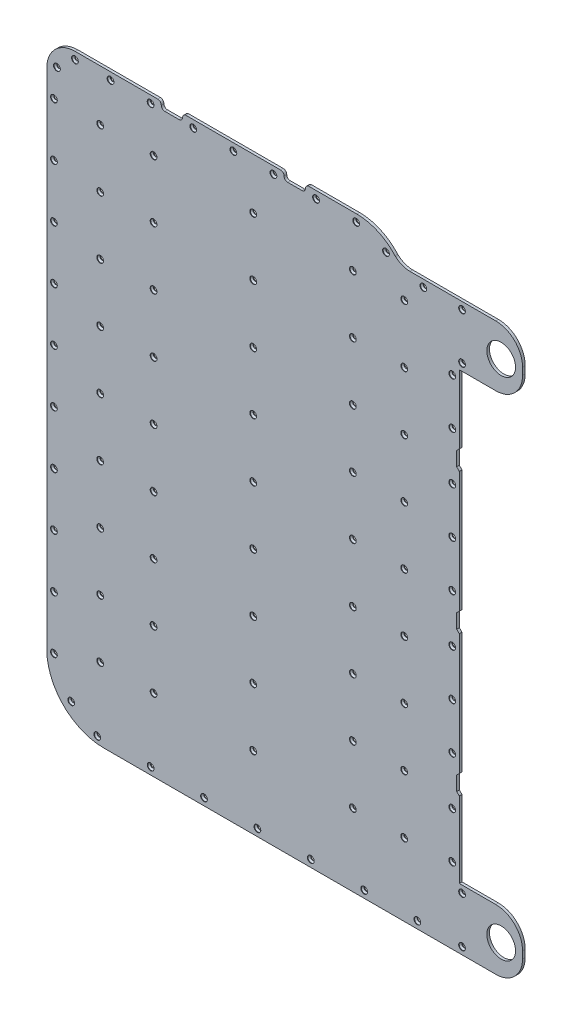
from build123d import *

# Parameters (mm, degrees)
SKETCH1_W                                      = 267.354069382
SKETCH1_H                                      = 331
BOSS_EXTRUDE1_DEPTH                            = 1.5
CUT_EXTRUDE1_DEPTH                             = 426.489657236
CUT_EXTRUDE2_DEPTH                             = 426.489657236
CUT_EXTRUDE3_DEPTH                             = 426.489657236
CUT_EXTRUDE4_DEPTH                             = 426.489657236
M14_CLEARANCE_HOLE1_D                          = 16.15
CSK_FOR_M2_FLAT_HEAD_MACHINE_SCREW1_AT_2_COUNT = 2
CSK_FOR_M2_FLAT_HEAD_MACHINE_SCREW1_AT_2_PITCH = 119.634610245
CSK_FOR_M2_FLAT_HEAD_MACHINE_SCREW1_AT_3_COUNT = 2
CSK_FOR_M2_FLAT_HEAD_MACHINE_SCREW1_AT_3_PITCH = 261.247192787
CSK_FOR_M2_FLAT_HEAD_MACHINE_SCREW1_AT_4_COUNT = 2
CSK_FOR_M2_FLAT_HEAD_MACHINE_SCREW1_AT_4_PITCH = 200.44941981
CSK_FOR_M2_FLAT_HEAD_MACHINE_SCREW1_AT_5_COUNT = 2
CSK_FOR_M2_FLAT_HEAD_MACHINE_SCREW1_AT_5_PITCH = 60
CSK_FOR_M2_FLAT_HEAD_MACHINE_SCREW1_AT_6_COUNT = 2
CSK_FOR_M2_FLAT_HEAD_MACHINE_SCREW1_AT_6_PITCH = 150
CSK_FOR_M2_FLAT_HEAD_MACHINE_SCREW1_AT_7_COUNT = 2
CSK_FOR_M2_FLAT_HEAD_MACHINE_SCREW1_AT_7_PITCH = 104.020522584
CSK_FOR_M2_FLAT_HEAD_MACHINE_SCREW1_AT_8_COUNT = 2
CSK_FOR_M2_FLAT_HEAD_MACHINE_SCREW1_AT_8_PITCH = 304.224078439
CSK_FOR_M2_FLAT_HEAD_MACHINE_SCREW1_AT_9_COUNT = 2
CSK_FOR_M2_FLAT_HEAD_MACHINE_SCREW1_AT_9_PITCH = 241.10255073
CSK_FOR_M2_FLAT_HEAD_MACHINE_SCREW1_AT_1_COUNT = 2
CSK_FOR_M2_FLAT_HEAD_MACHINE_SCREW1_AT_1_PITCH = 151.792937809
CSK_FOR_M2_FLAT_HEAD_MACHINE_SCREW1_2_COUNT    = 2
CSK_FOR_M2_FLAT_HEAD_MACHINE_SCREW1_2_PITCH    = 167.620476666
CSK_FOR_M2_FLAT_HEAD_MACHINE_SCREW1_3_COUNT    = 2
CSK_FOR_M2_FLAT_HEAD_MACHINE_SCREW1_3_PITCH    = 120
CSK_FOR_M2_FLAT_HEAD_MACHINE_SCREW1_4_COUNT    = 2
CSK_FOR_M2_FLAT_HEAD_MACHINE_SCREW1_4_PITCH    = 223.752496974
CSK_FOR_M2_FLAT_HEAD_MACHINE_SCREW1_5_COUNT    = 2
CSK_FOR_M2_FLAT_HEAD_MACHINE_SCREW1_5_PITCH    = 72.949696793
CSK_FOR_M2_FLAT_HEAD_MACHINE_SCREW1_6_COUNT    = 2
CSK_FOR_M2_FLAT_HEAD_MACHINE_SCREW1_6_PITCH    = 295.031085667
CSK_FOR_M2_FLAT_HEAD_MACHINE_SCREW1_7_COUNT    = 2
CSK_FOR_M2_FLAT_HEAD_MACHINE_SCREW1_7_PITCH    = 123.913581739
CSK_FOR_M2_FLAT_HEAD_MACHINE_SCREW1_8_COUNT    = 2
CSK_FOR_M2_FLAT_HEAD_MACHINE_SCREW1_8_PITCH    = 228.699238106
CSK_FOR_M2_FLAT_HEAD_MACHINE_SCREW1_9_COUNT    = 2
CSK_FOR_M2_FLAT_HEAD_MACHINE_SCREW1_9_PITCH    = 164.927901109
CSK_FOR_M2_FLAT_HEAD_MACHINE_SCREW1_10_COUNT   = 2
CSK_FOR_M2_FLAT_HEAD_MACHINE_SCREW1_10_PITCH   = 361.458404112
CSK_FOR_M2_FLAT_HEAD_MACHINE_SCREW1_11_COUNT   = 2
CSK_FOR_M2_FLAT_HEAD_MACHINE_SCREW1_11_PITCH   = 177.537391413
CSK_FOR_M2_FLAT_HEAD_MACHINE_SCREW1_12_COUNT   = 2
CSK_FOR_M2_FLAT_HEAD_MACHINE_SCREW1_12_PITCH   = 233.98480722
CSK_FOR_M2_FLAT_HEAD_MACHINE_SCREW1_13_COUNT   = 2
CSK_FOR_M2_FLAT_HEAD_MACHINE_SCREW1_13_PITCH   = 345.258369211
CSK_FOR_M2_FLAT_HEAD_MACHINE_SCREW1_14_COUNT   = 2
CSK_FOR_M2_FLAT_HEAD_MACHINE_SCREW1_14_PITCH   = 323.987285133
CSK_FOR_M2_FLAT_HEAD_MACHINE_SCREW1_15_COUNT   = 2
CSK_FOR_M2_FLAT_HEAD_MACHINE_SCREW1_15_PITCH   = 322.888559698
CSK_FOR_M2_FLAT_HEAD_MACHINE_SCREW1_16_COUNT   = 2
CSK_FOR_M2_FLAT_HEAD_MACHINE_SCREW1_16_PITCH   = 266.552202251
CSK_FOR_M2_FLAT_HEAD_MACHINE_SCREW1_17_COUNT   = 2
CSK_FOR_M2_FLAT_HEAD_MACHINE_SCREW1_17_PITCH   = 314.841229829
CSK_FOR_M2_FLAT_HEAD_MACHINE_SCREW1_18_COUNT   = 2
CSK_FOR_M2_FLAT_HEAD_MACHINE_SCREW1_18_PITCH   = 316.809987117
CSK_FOR_M2_FLAT_HEAD_MACHINE_SCREW1_19_COUNT   = 2
CSK_FOR_M2_FLAT_HEAD_MACHINE_SCREW1_19_PITCH   = 227.93936126
CSK_FOR_M2_FLAT_HEAD_MACHINE_SCREW1_20_COUNT   = 2
CSK_FOR_M2_FLAT_HEAD_MACHINE_SCREW1_20_PITCH   = 180.092587027
CSK_FOR_M2_FLAT_HEAD_MACHINE_SCREW1_21_COUNT   = 2
CSK_FOR_M2_FLAT_HEAD_MACHINE_SCREW1_21_PITCH   = 279.91283558
CSK_FOR_M2_FLAT_HEAD_MACHINE_SCREW1_22_COUNT   = 2
CSK_FOR_M2_FLAT_HEAD_MACHINE_SCREW1_22_PITCH   = 232.986660987
CSK_FOR_M2_FLAT_HEAD_MACHINE_SCREW1_23_COUNT   = 2
CSK_FOR_M2_FLAT_HEAD_MACHINE_SCREW1_23_PITCH   = 62.685137884
CSK_FOR_M2_FLAT_HEAD_MACHINE_SCREW1_24_COUNT   = 2
CSK_FOR_M2_FLAT_HEAD_MACHINE_SCREW1_24_PITCH   = 272.821168476
CSK_FOR_M2_FLAT_HEAD_MACHINE_SCREW1_25_COUNT   = 2
CSK_FOR_M2_FLAT_HEAD_MACHINE_SCREW1_25_PITCH   = 352.917909887
CSK_FOR_M2_FLAT_HEAD_MACHINE_SCREW1_26_COUNT   = 2
CSK_FOR_M2_FLAT_HEAD_MACHINE_SCREW1_26_PITCH   = 298.36766614
CSK_FOR_M2_FLAT_HEAD_MACHINE_SCREW1_27_COUNT   = 2
CSK_FOR_M2_FLAT_HEAD_MACHINE_SCREW1_27_PITCH   = 304.747305105
CSK_FOR_M2_FLAT_HEAD_MACHINE_SCREW1_28_COUNT   = 2
CSK_FOR_M2_FLAT_HEAD_MACHINE_SCREW1_28_PITCH   = 178.729628122
CSK_FOR_M2_FLAT_HEAD_MACHINE_SCREW1_29_COUNT   = 2
CSK_FOR_M2_FLAT_HEAD_MACHINE_SCREW1_29_PITCH   = 148.522961082
CSK_FOR_M2_FLAT_HEAD_MACHINE_SCREW1_30_COUNT   = 2
CSK_FOR_M2_FLAT_HEAD_MACHINE_SCREW1_30_PITCH   = 176.588055967
CSK_FOR_M2_FLAT_HEAD_MACHINE_SCREW1_31_COUNT   = 2
CSK_FOR_M2_FLAT_HEAD_MACHINE_SCREW1_31_PITCH   = 358.429099418
CSK_FOR_M2_FLAT_HEAD_MACHINE_SCREW1_32_COUNT   = 2
CSK_FOR_M2_FLAT_HEAD_MACHINE_SCREW1_32_PITCH   = 200.300809279
CSK_FOR_M2_FLAT_HEAD_MACHINE_SCREW1_33_COUNT   = 2
CSK_FOR_M2_FLAT_HEAD_MACHINE_SCREW1_33_PITCH   = 43.034312803
CSK_FOR_M2_FLAT_HEAD_MACHINE_SCREW1_34_COUNT   = 2
CSK_FOR_M2_FLAT_HEAD_MACHINE_SCREW1_34_PITCH   = 69.690273336
CSK_FOR_M2_FLAT_HEAD_MACHINE_SCREW1_35_COUNT   = 2
CSK_FOR_M2_FLAT_HEAD_MACHINE_SCREW1_35_PITCH   = 156.307695714
CSK_FOR_M2_FLAT_HEAD_MACHINE_SCREW1_36_COUNT   = 2
CSK_FOR_M2_FLAT_HEAD_MACHINE_SCREW1_36_PITCH   = 319.723851957
CSK_FOR_M2_FLAT_HEAD_MACHINE_SCREW1_37_COUNT   = 2
CSK_FOR_M2_FLAT_HEAD_MACHINE_SCREW1_37_PITCH   = 326.860477855
CSK_FOR_M2_FLAT_HEAD_MACHINE_SCREW1_38_COUNT   = 2
CSK_FOR_M2_FLAT_HEAD_MACHINE_SCREW1_38_PITCH   = 179.384296245
CSK_FOR_M2_FLAT_HEAD_MACHINE_SCREW1_39_COUNT   = 2
CSK_FOR_M2_FLAT_HEAD_MACHINE_SCREW1_39_PITCH   = 271.409914171
CSK_FOR_M2_FLAT_HEAD_MACHINE_SCREW1_40_COUNT   = 2
CSK_FOR_M2_FLAT_HEAD_MACHINE_SCREW1_40_PITCH   = 60.829191626
CSK_FOR_M2_FLAT_HEAD_MACHINE_SCREW1_41_COUNT   = 2
CSK_FOR_M2_FLAT_HEAD_MACHINE_SCREW1_41_PITCH   = 81.288620654
CSK_FOR_M2_FLAT_HEAD_MACHINE_SCREW1_42_COUNT   = 2
CSK_FOR_M2_FLAT_HEAD_MACHINE_SCREW1_42_PITCH   = 137.200749777
CSK_FOR_M2_FLAT_HEAD_MACHINE_SCREW1_43_COUNT   = 2
CSK_FOR_M2_FLAT_HEAD_MACHINE_SCREW1_43_PITCH   = 299.148530157
CSK_FOR_M2_FLAT_HEAD_MACHINE_SCREW1_44_COUNT   = 2
CSK_FOR_M2_FLAT_HEAD_MACHINE_SCREW1_44_PITCH   = 136.663128881
CSK_FOR_M2_FLAT_HEAD_MACHINE_SCREW1_45_COUNT   = 2
CSK_FOR_M2_FLAT_HEAD_MACHINE_SCREW1_45_PITCH   = 336.827510729
CSK_FOR_M2_FLAT_HEAD_MACHINE_SCREW1_46_COUNT   = 2
CSK_FOR_M2_FLAT_HEAD_MACHINE_SCREW1_46_PITCH   = 331.117837006
CSK_FOR_M2_FLAT_HEAD_MACHINE_SCREW1_47_COUNT   = 2
CSK_FOR_M2_FLAT_HEAD_MACHINE_SCREW1_47_PITCH   = 320.921447927
CSK_FOR_M2_FLAT_HEAD_MACHINE_SCREW1_48_COUNT   = 2
CSK_FOR_M2_FLAT_HEAD_MACHINE_SCREW1_48_PITCH   = 344.446706307
CSK_FOR_M2_FLAT_HEAD_MACHINE_SCREW1_49_COUNT   = 2
CSK_FOR_M2_FLAT_HEAD_MACHINE_SCREW1_49_PITCH   = 209.685645595
CSK_FOR_M2_FLAT_HEAD_MACHINE_SCREW1_50_COUNT   = 2
CSK_FOR_M2_FLAT_HEAD_MACHINE_SCREW1_50_PITCH   = 90
CSK_FOR_M2_FLAT_HEAD_MACHINE_SCREW1_51_COUNT   = 2
CSK_FOR_M2_FLAT_HEAD_MACHINE_SCREW1_51_PITCH   = 152.826110015
CSK_FOR_M2_FLAT_HEAD_MACHINE_SCREW1_52_COUNT   = 2
CSK_FOR_M2_FLAT_HEAD_MACHINE_SCREW1_52_PITCH   = 93.297320264
CSK_FOR_M2_FLAT_HEAD_MACHINE_SCREW1_53_COUNT   = 2
CSK_FOR_M2_FLAT_HEAD_MACHINE_SCREW1_53_PITCH   = 289.276684162
CSK_FOR_M2_FLAT_HEAD_MACHINE_SCREW1_54_COUNT   = 2
CSK_FOR_M2_FLAT_HEAD_MACHINE_SCREW1_54_PITCH   = 311.778234918
CSK_FOR_M2_FLAT_HEAD_MACHINE_SCREW1_55_COUNT   = 2
CSK_FOR_M2_FLAT_HEAD_MACHINE_SCREW1_55_PITCH   = 254.363483823
CSK_FOR_M2_FLAT_HEAD_MACHINE_SCREW1_56_COUNT   = 2
CSK_FOR_M2_FLAT_HEAD_MACHINE_SCREW1_56_PITCH   = 201.460377121
CSK_FOR_M2_FLAT_HEAD_MACHINE_SCREW1_57_COUNT   = 2
CSK_FOR_M2_FLAT_HEAD_MACHINE_SCREW1_57_PITCH   = 202.637456713
CSK_FOR_M2_FLAT_HEAD_MACHINE_SCREW1_58_COUNT   = 2
CSK_FOR_M2_FLAT_HEAD_MACHINE_SCREW1_58_PITCH   = 169.003719323
CSK_FOR_M2_FLAT_HEAD_MACHINE_SCREW1_59_COUNT   = 2
CSK_FOR_M2_FLAT_HEAD_MACHINE_SCREW1_59_PITCH   = 290.77662516
CSK_FOR_M2_FLAT_HEAD_MACHINE_SCREW1_60_COUNT   = 2
CSK_FOR_M2_FLAT_HEAD_MACHINE_SCREW1_60_PITCH   = 265.675994771
CSK_FOR_M2_FLAT_HEAD_MACHINE_SCREW1_61_COUNT   = 2
CSK_FOR_M2_FLAT_HEAD_MACHINE_SCREW1_61_PITCH   = 205.094943232
CSK_FOR_M2_FLAT_HEAD_MACHINE_SCREW1_62_COUNT   = 2
CSK_FOR_M2_FLAT_HEAD_MACHINE_SCREW1_62_PITCH   = 210.531093927
CSK_FOR_M2_FLAT_HEAD_MACHINE_SCREW1_63_COUNT   = 2
CSK_FOR_M2_FLAT_HEAD_MACHINE_SCREW1_63_PITCH   = 30
CSK_FOR_M2_FLAT_HEAD_MACHINE_SCREW1_64_COUNT   = 2
CSK_FOR_M2_FLAT_HEAD_MACHINE_SCREW1_64_PITCH   = 183.748038112
CSK_FOR_M2_FLAT_HEAD_MACHINE_SCREW1_65_COUNT   = 2
CSK_FOR_M2_FLAT_HEAD_MACHINE_SCREW1_65_PITCH   = 72.352746793
CSK_FOR_M2_FLAT_HEAD_MACHINE_SCREW1_66_COUNT   = 2
CSK_FOR_M2_FLAT_HEAD_MACHINE_SCREW1_66_PITCH   = 195.303204045
CSK_FOR_M2_FLAT_HEAD_MACHINE_SCREW1_67_COUNT   = 2
CSK_FOR_M2_FLAT_HEAD_MACHINE_SCREW1_67_PITCH   = 249.176583776
CSK_FOR_M2_FLAT_HEAD_MACHINE_SCREW1_68_COUNT   = 2
CSK_FOR_M2_FLAT_HEAD_MACHINE_SCREW1_68_PITCH   = 276.1364516
CSK_FOR_M2_FLAT_HEAD_MACHINE_SCREW1_69_COUNT   = 2
CSK_FOR_M2_FLAT_HEAD_MACHINE_SCREW1_69_PITCH   = 102.297527818
CSK_FOR_M2_FLAT_HEAD_MACHINE_SCREW1_70_COUNT   = 2
CSK_FOR_M2_FLAT_HEAD_MACHINE_SCREW1_70_PITCH   = 127.493852896
CSK_FOR_M2_FLAT_HEAD_MACHINE_SCREW1_71_COUNT   = 2
CSK_FOR_M2_FLAT_HEAD_MACHINE_SCREW1_71_PITCH   = 104.546374884
CSK_FOR_M2_FLAT_HEAD_MACHINE_SCREW1_72_COUNT   = 2
CSK_FOR_M2_FLAT_HEAD_MACHINE_SCREW1_72_PITCH   = 249.165289537
CSK_FOR_M2_FLAT_HEAD_MACHINE_SCREW1_73_COUNT   = 2
CSK_FOR_M2_FLAT_HEAD_MACHINE_SCREW1_73_PITCH   = 232.567679911
CSK_FOR_M2_FLAT_HEAD_MACHINE_SCREW1_74_COUNT   = 2
CSK_FOR_M2_FLAT_HEAD_MACHINE_SCREW1_74_PITCH   = 37.245995727
CSK_FOR_M2_FLAT_HEAD_MACHINE_SCREW1_75_COUNT   = 2
CSK_FOR_M2_FLAT_HEAD_MACHINE_SCREW1_75_PITCH   = 29.875
CSK_FOR_M2_FLAT_HEAD_MACHINE_SCREW1_76_COUNT   = 2
CSK_FOR_M2_FLAT_HEAD_MACHINE_SCREW1_76_PITCH   = 134.949672833
CSK_FOR_M2_FLAT_HEAD_MACHINE_SCREW1_77_COUNT   = 2
CSK_FOR_M2_FLAT_HEAD_MACHINE_SCREW1_77_PITCH   = 163.784278556
CSK_FOR_M2_FLAT_HEAD_MACHINE_SCREW1_78_COUNT   = 2
CSK_FOR_M2_FLAT_HEAD_MACHINE_SCREW1_78_PITCH   = 55
CSK_FOR_M2_FLAT_HEAD_MACHINE_SCREW1_79_COUNT   = 2
CSK_FOR_M2_FLAT_HEAD_MACHINE_SCREW1_79_PITCH   = 333.154348467
FILLET1_R                                      = 12
FILLET2_R                                      = 16
FILLET3_R                                      = 32
FILLET4_R                                      = 15


with BuildPart() as part:
    # Sketch1 → Boss-Extrude1 (new body)
    with BuildSketch(Plane.XY.offset(1.5)):
        with Locations((133.677034691, 165.5)):
            Rectangle(SKETCH1_W, SKETCH1_H)
    extrude(amount=-BOSS_EXTRUDE1_DEPTH)

    # Sketch2 → Cut-Extrude1 (cut, through all)
    with BuildSketch(Plane(origin=(0, 0, 0), x_dir=(-1, 0, 0), z_dir=(0, 0, -1))):
        Polygon((-267.354069382, 284), (-267.354069382, 33.984429066), (-231.807915836, 33.984429066), (-231.814759233, 76.575880869), (-230.354069382, 78), (-230.354069382, 86), (-231.816514469, 87.5), (-231.827440394, 155.5), (-230.354069382, 157), (-230.354069382, 165), (-231.829207823, 166.5), (-231.840133747, 234.5), (-230.354069382, 236), (-230.354069382, 244), (-231.841901176, 245.5), (-231.848087178, 284), align=None)
    extrude(amount=-CUT_EXTRUDE1_DEPTH, mode=Mode.SUBTRACT)

    # Sketch3 → Cut-Extrude2 (cut, through all)
    with BuildSketch(Plane(origin=(0, 0, 0), x_dir=(-1, 0, 0), z_dir=(0, 0, -1))):
        with BuildLine():
            Line((-174.225389185, 331), (-267.354069382, 331))
            Line((-267.354069382, 331), (-267.354069382, 318))
            Line((-267.354069382, 318), (-199.499948995, 318))
            Line((-199.499948995, 318), (-195.692740955, 321.412638885))
            ThreePointArc((-195.692740955, 321.412638885), (-185.974632113, 328.480306486), (-174.225389185, 331))
        make_face()
    extrude(amount=-CUT_EXTRUDE2_DEPTH, mode=Mode.SUBTRACT)

    # Sketch4 → Cut-Extrude3 (cut, through all)
    with BuildSketch(Plane(origin=(0, 0, 0), x_dir=(-1, 0, 0), z_dir=(0, 0, -1))):
        with BuildLine():
            Line((-131.354069382, 331), (-147.354069382, 331))
            ThreePointArc((-147.354069382, 331), (-145.93985582, 330.414213562), (-145.354069382, 329))
            ThreePointArc((-145.354069382, 329), (-144.768282945, 327.585786438), (-143.354069382, 327))
            Line((-143.354069382, 327), (-135.354069382, 327))
            ThreePointArc((-135.354069382, 327), (-133.93985582, 327.585786438), (-133.354069382, 329))
            ThreePointArc((-133.354069382, 329), (-132.768282945, 330.414213562), (-131.354069382, 331))
        make_face()
    extrude(amount=-CUT_EXTRUDE3_DEPTH, mode=Mode.SUBTRACT)

    # Sketch5 → Cut-Extrude4 (cut, through all)
    with BuildSketch(Plane(origin=(0, 0, 0), x_dir=(-1, 0, 0), z_dir=(0, 0, -1))):
        with BuildLine():
            Line((-62.325899763, 331), (-78.325899763, 331))
            ThreePointArc((-78.325899763, 331), (-76.911686201, 330.414213562), (-76.325899763, 329))
            ThreePointArc((-76.325899763, 329), (-75.740113325, 327.585786438), (-74.325899763, 327))
            Line((-74.325899763, 327), (-66.325899763, 327))
            ThreePointArc((-66.325899763, 327), (-64.911686201, 327.585786438), (-64.325899763, 329))
            ThreePointArc((-64.325899763, 329), (-63.740113325, 330.414213562), (-62.325899763, 331))
        make_face()
    extrude(amount=-CUT_EXTRUDE4_DEPTH, mode=Mode.SUBTRACT)

    # M14 Clearance Hole1 (through all)
    with Locations(Plane.XY.offset(1.5)):
        with Locations((255.354069382, 16.992214533), (255.354069382, 301.007785467)):
            Hole(M14_CLEARANCE_HOLE1_D / 2)

    # Sketch8 → CSK for M2 Flat Head Machine Screw1 (revolve, cut)
    with BuildSketch(Plane(origin=(178.354069382, 4, 1.5), x_dir=(0, -1, 0), z_dir=(1, 0, 0))):
        Polygon((0, 0), (0, 1.5), (1.1, 1.5), (1.1, 1.1), (1.9, 0.3), (1.9, 0), align=None)
    csk_for_m2_flat_head_machine_screw1 = revolve(axis=Axis((178.354069382, 4, 7.85), (0, 0, -1)), mode=Mode.SUBTRACT)

    # CSK for M2 Flat Head Machine Screw1 at 2: CSK for M2 Flat Head Machine Screw1 ×2
    with Locations(*[Vector(-0.5212042673470071, 0.8534319607908234, 0) * (i * CSK_FOR_M2_FLAT_HEAD_MACHINE_SCREW1_AT_2_PITCH) for i in range(1, CSK_FOR_M2_FLAT_HEAD_MACHINE_SCREW1_AT_2_COUNT)]):
        add(csk_for_m2_flat_head_machine_screw1, mode=Mode.SUBTRACT)

    # CSK for M2 Flat Head Machine Screw1 at 3: CSK for M2 Flat Head Machine Screw1 ×2
    with Locations(*[Vector(-0.45303479864942126, 0.8914928329564284, 0) * (i * CSK_FOR_M2_FLAT_HEAD_MACHINE_SCREW1_AT_3_PITCH) for i in range(1, CSK_FOR_M2_FLAT_HEAD_MACHINE_SCREW1_AT_3_COUNT)]):
        add(csk_for_m2_flat_head_machine_screw1, mode=Mode.SUBTRACT)

    # CSK for M2 Flat Head Machine Screw1 at 4: CSK for M2 Flat Head Machine Screw1 ×2
    with Locations(*[Vector(-0.7401072526058902, 0.6724888509411597, 0) * (i * CSK_FOR_M2_FLAT_HEAD_MACHINE_SCREW1_AT_4_PITCH) for i in range(1, CSK_FOR_M2_FLAT_HEAD_MACHINE_SCREW1_AT_4_COUNT)]):
        add(csk_for_m2_flat_head_machine_screw1, mode=Mode.SUBTRACT)

    # CSK for M2 Flat Head Machine Screw1 at 5: CSK for M2 Flat Head Machine Screw1 ×2
    with Locations(*[(-i * CSK_FOR_M2_FLAT_HEAD_MACHINE_SCREW1_AT_5_PITCH, 0, 0) for i in range(1, CSK_FOR_M2_FLAT_HEAD_MACHINE_SCREW1_AT_5_COUNT)]):
        add(csk_for_m2_flat_head_machine_screw1, mode=Mode.SUBTRACT)

    # CSK for M2 Flat Head Machine Screw1 at 6: CSK for M2 Flat Head Machine Screw1 ×2
    with Locations(*[(-i * CSK_FOR_M2_FLAT_HEAD_MACHINE_SCREW1_AT_6_PITCH, 0, 0) for i in range(1, CSK_FOR_M2_FLAT_HEAD_MACHINE_SCREW1_AT_6_COUNT)]):
        add(csk_for_m2_flat_head_machine_screw1, mode=Mode.SUBTRACT)

    # CSK for M2 Flat Head Machine Screw1 at 7: CSK for M2 Flat Head Machine Screw1 ×2
    with Locations(*[Vector(0.47565095314554157, 0.8796341118736459, 0) * (i * CSK_FOR_M2_FLAT_HEAD_MACHINE_SCREW1_AT_7_PITCH) for i in range(1, CSK_FOR_M2_FLAT_HEAD_MACHINE_SCREW1_AT_7_COUNT)]):
        add(csk_for_m2_flat_head_machine_screw1, mode=Mode.SUBTRACT)

    # CSK for M2 Flat Head Machine Screw1 at 8: CSK for M2 Flat Head Machine Screw1 ×2
    with Locations(*[Vector(-0.4876473622444672, 0.8730406921192239, 0) * (i * CSK_FOR_M2_FLAT_HEAD_MACHINE_SCREW1_AT_8_PITCH) for i in range(1, CSK_FOR_M2_FLAT_HEAD_MACHINE_SCREW1_AT_8_COUNT)]):
        add(csk_for_m2_flat_head_machine_screw1, mode=Mode.SUBTRACT)

    # CSK for M2 Flat Head Machine Screw1 at 9: CSK for M2 Flat Head Machine Screw1 ×2
    with Locations(*[Vector(-0.2586205297015454, 0.9659789964677763, 0) * (i * CSK_FOR_M2_FLAT_HEAD_MACHINE_SCREW1_AT_9_PITCH) for i in range(1, CSK_FOR_M2_FLAT_HEAD_MACHINE_SCREW1_AT_9_COUNT)]):
        add(csk_for_m2_flat_head_machine_screw1, mode=Mode.SUBTRACT)

    # CSK for M2 Flat Head Machine Screw1 at 1: CSK for M2 Flat Head Machine Screw1 ×2
    with Locations(*[Vector(0.32600868358523344, 0.9453667744463116, 0) * (i * CSK_FOR_M2_FLAT_HEAD_MACHINE_SCREW1_AT_1_PITCH) for i in range(1, CSK_FOR_M2_FLAT_HEAD_MACHINE_SCREW1_AT_1_COUNT)]):
        add(csk_for_m2_flat_head_machine_screw1, mode=Mode.SUBTRACT)

    # CSK for M2 Flat Head Machine Screw1  2: CSK for M2 Flat Head Machine Screw1 ×2
    with Locations(*[Vector(-0.0379074771088598, 0.999281253291205, 0) * (i * CSK_FOR_M2_FLAT_HEAD_MACHINE_SCREW1_2_PITCH) for i in range(1, CSK_FOR_M2_FLAT_HEAD_MACHINE_SCREW1_2_COUNT)]):
        add(csk_for_m2_flat_head_machine_screw1, mode=Mode.SUBTRACT)

    # CSK for M2 Flat Head Machine Screw1  3: CSK for M2 Flat Head Machine Screw1 ×2
    with Locations(*[(-i * CSK_FOR_M2_FLAT_HEAD_MACHINE_SCREW1_3_PITCH, 0, 0) for i in range(1, CSK_FOR_M2_FLAT_HEAD_MACHINE_SCREW1_3_COUNT)]):
        add(csk_for_m2_flat_head_machine_screw1, mode=Mode.SUBTRACT)

    # CSK for M2 Flat Head Machine Screw1  4: CSK for M2 Flat Head Machine Screw1 ×2
    with Locations(*[Vector(-0.6630275477962505, 0.7485949978882379, 0) * (i * CSK_FOR_M2_FLAT_HEAD_MACHINE_SCREW1_4_PITCH) for i in range(1, CSK_FOR_M2_FLAT_HEAD_MACHINE_SCREW1_4_COUNT)]):
        add(csk_for_m2_flat_head_machine_screw1, mode=Mode.SUBTRACT)

    # CSK for M2 Flat Head Machine Screw1  5: CSK for M2 Flat Head Machine Screw1 ×2
    with Locations(*[Vector(0.3081416552854714, 0.9513404859869729, 0) * (i * CSK_FOR_M2_FLAT_HEAD_MACHINE_SCREW1_5_PITCH) for i in range(1, CSK_FOR_M2_FLAT_HEAD_MACHINE_SCREW1_5_COUNT)]):
        add(csk_for_m2_flat_head_machine_screw1, mode=Mode.SUBTRACT)

    # CSK for M2 Flat Head Machine Screw1  6: CSK for M2 Flat Head Machine Screw1 ×2
    with Locations(*[Vector(-0.5909684702807935, 0.8066946554514782, 0) * (i * CSK_FOR_M2_FLAT_HEAD_MACHINE_SCREW1_6_PITCH) for i in range(1, CSK_FOR_M2_FLAT_HEAD_MACHINE_SCREW1_6_COUNT)]):
        add(csk_for_m2_flat_head_machine_screw1, mode=Mode.SUBTRACT)

    # CSK for M2 Flat Head Machine Screw1  7: CSK for M2 Flat Head Machine Screw1 ×2
    with Locations(*[Vector(-0.9551339548212321, 0.2961741520584681, 0) * (i * CSK_FOR_M2_FLAT_HEAD_MACHINE_SCREW1_7_PITCH) for i in range(1, CSK_FOR_M2_FLAT_HEAD_MACHINE_SCREW1_7_COUNT)]):
        add(csk_for_m2_flat_head_machine_screw1, mode=Mode.SUBTRACT)

    # CSK for M2 Flat Head Machine Screw1  8: CSK for M2 Flat Head Machine Screw1 ×2
    with Locations(*[Vector(-0.7623727600771633, 0.6471381418926937, 0) * (i * CSK_FOR_M2_FLAT_HEAD_MACHINE_SCREW1_8_PITCH) for i in range(1, CSK_FOR_M2_FLAT_HEAD_MACHINE_SCREW1_8_COUNT)]):
        add(csk_for_m2_flat_head_machine_screw1, mode=Mode.SUBTRACT)

    # CSK for M2 Flat Head Machine Screw1  9: CSK for M2 Flat Head Machine Screw1 ×2
    with Locations(*[Vector(-0.9983396882840878, 0.05760092704835812, 0) * (i * CSK_FOR_M2_FLAT_HEAD_MACHINE_SCREW1_9_PITCH) for i in range(1, CSK_FOR_M2_FLAT_HEAD_MACHINE_SCREW1_9_COUNT)]):
        add(csk_for_m2_flat_head_machine_screw1, mode=Mode.SUBTRACT)

    # CSK for M2 Flat Head Machine Screw1  10: CSK for M2 Flat Head Machine Screw1 ×2
    with Locations(*[Vector(-0.4496455685361018, 0.8932070659683822, 0) * (i * CSK_FOR_M2_FLAT_HEAD_MACHINE_SCREW1_10_PITCH) for i in range(1, CSK_FOR_M2_FLAT_HEAD_MACHINE_SCREW1_10_COUNT)]):
        add(csk_for_m2_flat_head_machine_screw1, mode=Mode.SUBTRACT)

    # CSK for M2 Flat Head Machine Screw1  11: CSK for M2 Flat Head Machine Screw1 ×2
    with Locations(*[Vector(0.27875904717026245, 0.9603610746072164, 0) * (i * CSK_FOR_M2_FLAT_HEAD_MACHINE_SCREW1_11_PITCH) for i in range(1, CSK_FOR_M2_FLAT_HEAD_MACHINE_SCREW1_11_COUNT)]):
        add(csk_for_m2_flat_head_machine_screw1, mode=Mode.SUBTRACT)

    # CSK for M2 Flat Head Machine Screw1  12: CSK for M2 Flat Head Machine Screw1 ×2
    with Locations(*[Vector(0.0961819316869119, 0.995363770697414, 0) * (i * CSK_FOR_M2_FLAT_HEAD_MACHINE_SCREW1_12_PITCH) for i in range(1, CSK_FOR_M2_FLAT_HEAD_MACHINE_SCREW1_12_COUNT)]):
        add(csk_for_m2_flat_head_machine_screw1, mode=Mode.SUBTRACT)

    # CSK for M2 Flat Head Machine Screw1  13: CSK for M2 Flat Head Machine Screw1 ×2
    with Locations(*[Vector(-0.5049959245903639, 0.8631217273056702, 0) * (i * CSK_FOR_M2_FLAT_HEAD_MACHINE_SCREW1_13_PITCH) for i in range(1, CSK_FOR_M2_FLAT_HEAD_MACHINE_SCREW1_13_COUNT)]):
        add(csk_for_m2_flat_head_machine_screw1, mode=Mode.SUBTRACT)

    # CSK for M2 Flat Head Machine Screw1  14: CSK for M2 Flat Head Machine Screw1 ×2
    with Locations(*[Vector(-0.08345021070280355, 0.9965119479131486, 0) * (i * CSK_FOR_M2_FLAT_HEAD_MACHINE_SCREW1_14_PITCH) for i in range(1, CSK_FOR_M2_FLAT_HEAD_MACHINE_SCREW1_14_COUNT)]):
        add(csk_for_m2_flat_head_machine_screw1, mode=Mode.SUBTRACT)

    # CSK for M2 Flat Head Machine Screw1  15: CSK for M2 Flat Head Machine Screw1 ×2
    with Locations(*[Vector(-0.01393669693411205, 0.9999028795230899, 0) * (i * CSK_FOR_M2_FLAT_HEAD_MACHINE_SCREW1_15_PITCH) for i in range(1, CSK_FOR_M2_FLAT_HEAD_MACHINE_SCREW1_15_COUNT)]):
        add(csk_for_m2_flat_head_machine_screw1, mode=Mode.SUBTRACT)

    # CSK for M2 Flat Head Machine Screw1  16: CSK for M2 Flat Head Machine Screw1 ×2
    with Locations(*[Vector(0.08445011760532944, 0.9964277081838131, 0) * (i * CSK_FOR_M2_FLAT_HEAD_MACHINE_SCREW1_16_PITCH) for i in range(1, CSK_FOR_M2_FLAT_HEAD_MACHINE_SCREW1_16_COUNT)]):
        add(csk_for_m2_flat_head_machine_screw1, mode=Mode.SUBTRACT)

    # CSK for M2 Flat Head Machine Screw1  17: CSK for M2 Flat Head Machine Screw1 ×2
    with Locations(*[Vector(0.1746912246211783, 0.9846232660466404, 0) * (i * CSK_FOR_M2_FLAT_HEAD_MACHINE_SCREW1_17_PITCH) for i in range(1, CSK_FOR_M2_FLAT_HEAD_MACHINE_SCREW1_17_COUNT)]):
        add(csk_for_m2_flat_head_machine_screw1, mode=Mode.SUBTRACT)

    # CSK for M2 Flat Head Machine Screw1  18: CSK for M2 Flat Head Machine Screw1 ×2
    with Locations(*[Vector(0.03866858121133907, 0.9992520907294126, 0) * (i * CSK_FOR_M2_FLAT_HEAD_MACHINE_SCREW1_18_PITCH) for i in range(1, CSK_FOR_M2_FLAT_HEAD_MACHINE_SCREW1_18_COUNT)]):
        add(csk_for_m2_flat_head_machine_screw1, mode=Mode.SUBTRACT)

    # CSK for M2 Flat Head Machine Screw1  19: CSK for M2 Flat Head Machine Screw1 ×2
    with Locations(*[Vector(0.21715647930376925, 0.9761368057277585, 0) * (i * CSK_FOR_M2_FLAT_HEAD_MACHINE_SCREW1_19_PITCH) for i in range(1, CSK_FOR_M2_FLAT_HEAD_MACHINE_SCREW1_19_COUNT)]):
        add(csk_for_m2_flat_head_machine_screw1, mode=Mode.SUBTRACT)

    # CSK for M2 Flat Head Machine Screw1  20: CSK for M2 Flat Head Machine Screw1 ×2
    with Locations(*[Vector(-0.8237655521020476, 0.5669306087785425, 0) * (i * CSK_FOR_M2_FLAT_HEAD_MACHINE_SCREW1_20_PITCH) for i in range(1, CSK_FOR_M2_FLAT_HEAD_MACHINE_SCREW1_20_COUNT)]):
        add(csk_for_m2_flat_head_machine_screw1, mode=Mode.SUBTRACT)

    # CSK for M2 Flat Head Machine Screw1  21: CSK for M2 Flat Head Machine Screw1 ×2
    with Locations(*[Vector(0.17686586210838603, 0.9842349652499943, 0) * (i * CSK_FOR_M2_FLAT_HEAD_MACHINE_SCREW1_21_PITCH) for i in range(1, CSK_FOR_M2_FLAT_HEAD_MACHINE_SCREW1_21_COUNT)]):
        add(csk_for_m2_flat_head_machine_screw1, mode=Mode.SUBTRACT)

    # CSK for M2 Flat Head Machine Screw1  22: CSK for M2 Flat Head Machine Screw1 ×2
    with Locations(*[Vector(-0.027272245352079116, 0.9996280431407755, 0) * (i * CSK_FOR_M2_FLAT_HEAD_MACHINE_SCREW1_22_PITCH) for i in range(1, CSK_FOR_M2_FLAT_HEAD_MACHINE_SCREW1_22_COUNT)]):
        add(csk_for_m2_flat_head_machine_screw1, mode=Mode.SUBTRACT)

    # CSK for M2 Flat Head Machine Screw1  23: CSK for M2 Flat Head Machine Screw1 ×2
    with Locations(*[Vector(0.7891654479841002, 0.6141806702494427, 0) * (i * CSK_FOR_M2_FLAT_HEAD_MACHINE_SCREW1_23_PITCH) for i in range(1, CSK_FOR_M2_FLAT_HEAD_MACHINE_SCREW1_23_COUNT)]):
        add(csk_for_m2_flat_head_machine_screw1, mode=Mode.SUBTRACT)

    # CSK for M2 Flat Head Machine Screw1  24: CSK for M2 Flat Head Machine Screw1 ×2
    with Locations(*[Vector(-0.22855290053386507, 0.9735314949489602, 0) * (i * CSK_FOR_M2_FLAT_HEAD_MACHINE_SCREW1_24_PITCH) for i in range(1, CSK_FOR_M2_FLAT_HEAD_MACHINE_SCREW1_24_COUNT)]):
        add(csk_for_m2_flat_head_machine_screw1, mode=Mode.SUBTRACT)

    # CSK for M2 Flat Head Machine Screw1  25: CSK for M2 Flat Head Machine Screw1 ×2
    with Locations(*[Vector(-0.40385643694047463, 0.9148223752957426, 0) * (i * CSK_FOR_M2_FLAT_HEAD_MACHINE_SCREW1_25_PITCH) for i in range(1, CSK_FOR_M2_FLAT_HEAD_MACHINE_SCREW1_25_COUNT)]):
        add(csk_for_m2_flat_head_machine_screw1, mode=Mode.SUBTRACT)

    # CSK for M2 Flat Head Machine Screw1  26: CSK for M2 Flat Head Machine Screw1 ×2
    with Locations(*[Vector(-0.021296105789199906, 0.9997732122227597, 0) * (i * CSK_FOR_M2_FLAT_HEAD_MACHINE_SCREW1_26_PITCH) for i in range(1, CSK_FOR_M2_FLAT_HEAD_MACHINE_SCREW1_26_COUNT)]):
        add(csk_for_m2_flat_head_machine_screw1, mode=Mode.SUBTRACT)

    # CSK for M2 Flat Head Machine Screw1  27: CSK for M2 Flat Head Machine Screw1 ×2
    with Locations(*[Vector(-0.20460909198454397, 0.9788437666335014, 0) * (i * CSK_FOR_M2_FLAT_HEAD_MACHINE_SCREW1_27_PITCH) for i in range(1, CSK_FOR_M2_FLAT_HEAD_MACHINE_SCREW1_27_COUNT)]):
        add(csk_for_m2_flat_head_machine_screw1, mode=Mode.SUBTRACT)

    # CSK for M2 Flat Head Machine Screw1  28: CSK for M2 Flat Head Machine Screw1 ×2
    with Locations(*[Vector(-0.348873715217122, 0.9371697449398388, 0) * (i * CSK_FOR_M2_FLAT_HEAD_MACHINE_SCREW1_28_PITCH) for i in range(1, CSK_FOR_M2_FLAT_HEAD_MACHINE_SCREW1_28_COUNT)]):
        add(csk_for_m2_flat_head_machine_screw1, mode=Mode.SUBTRACT)

    # CSK for M2 Flat Head Machine Screw1  29: CSK for M2 Flat Head Machine Screw1 ×2
    with Locations(*[Vector(-0.4198278093030311, 0.9076037739761872, 0) * (i * CSK_FOR_M2_FLAT_HEAD_MACHINE_SCREW1_29_PITCH) for i in range(1, CSK_FOR_M2_FLAT_HEAD_MACHINE_SCREW1_29_COUNT)]):
        add(csk_for_m2_flat_head_machine_screw1, mode=Mode.SUBTRACT)

    # CSK for M2 Flat Head Machine Screw1  30: CSK for M2 Flat Head Machine Screw1 ×2
    with Locations(*[Vector(-0.987349163722498, 0.15856112038101908, 0) * (i * CSK_FOR_M2_FLAT_HEAD_MACHINE_SCREW1_30_PITCH) for i in range(1, CSK_FOR_M2_FLAT_HEAD_MACHINE_SCREW1_30_COUNT)]):
        add(csk_for_m2_flat_head_machine_screw1, mode=Mode.SUBTRACT)

    # CSK for M2 Flat Head Machine Screw1  31: CSK for M2 Flat Head Machine Screw1 ×2
    with Locations(*[Vector(-0.48168167402311796, 0.8763462585703705, 0) * (i * CSK_FOR_M2_FLAT_HEAD_MACHINE_SCREW1_31_PITCH) for i in range(1, CSK_FOR_M2_FLAT_HEAD_MACHINE_SCREW1_31_COUNT)]):
        add(csk_for_m2_flat_head_machine_screw1, mode=Mode.SUBTRACT)

    # CSK for M2 Flat Head Machine Screw1  32: CSK for M2 Flat Head Machine Screw1 ×2
    with Locations(*[Vector(-0.03172263459678756, 0.9994967105769977, 0) * (i * CSK_FOR_M2_FLAT_HEAD_MACHINE_SCREW1_32_PITCH) for i in range(1, CSK_FOR_M2_FLAT_HEAD_MACHINE_SCREW1_32_COUNT)]):
        add(csk_for_m2_flat_head_machine_screw1, mode=Mode.SUBTRACT)

    # CSK for M2 Flat Head Machine Screw1  33: CSK for M2 Flat Head Machine Screw1 ×2
    with Locations(*[Vector(0.5222248195577818, 0.8528078551689368, 0) * (i * CSK_FOR_M2_FLAT_HEAD_MACHINE_SCREW1_33_PITCH) for i in range(1, CSK_FOR_M2_FLAT_HEAD_MACHINE_SCREW1_33_COUNT)]):
        add(csk_for_m2_flat_head_machine_screw1, mode=Mode.SUBTRACT)

    # CSK for M2 Flat Head Machine Screw1  34: CSK for M2 Flat Head Machine Screw1 ×2
    with Locations(*[Vector(-0.09117584245237277, 0.9958348084662939, 0) * (i * CSK_FOR_M2_FLAT_HEAD_MACHINE_SCREW1_34_PITCH) for i in range(1, CSK_FOR_M2_FLAT_HEAD_MACHINE_SCREW1_34_COUNT)]):
        add(csk_for_m2_flat_head_machine_screw1, mode=Mode.SUBTRACT)

    # CSK for M2 Flat Head Machine Screw1  35: CSK for M2 Flat Head Machine Screw1 ×2
    with Locations(*[Vector(-0.7571864510048067, 0.6531988046642043, 0) * (i * CSK_FOR_M2_FLAT_HEAD_MACHINE_SCREW1_35_PITCH) for i in range(1, CSK_FOR_M2_FLAT_HEAD_MACHINE_SCREW1_35_COUNT)]):
        add(csk_for_m2_flat_head_machine_screw1, mode=Mode.SUBTRACT)

    # CSK for M2 Flat Head Machine Screw1  36: CSK for M2 Flat Head Machine Screw1 ×2
    with Locations(*[Vector(-0.5453270636990749, 0.8382233554353787, 0) * (i * CSK_FOR_M2_FLAT_HEAD_MACHINE_SCREW1_36_PITCH) for i in range(1, CSK_FOR_M2_FLAT_HEAD_MACHINE_SCREW1_36_COUNT)]):
        add(csk_for_m2_flat_head_machine_screw1, mode=Mode.SUBTRACT)

    # CSK for M2 Flat Head Machine Screw1  37: CSK for M2 Flat Head Machine Screw1 ×2
    with Locations(*[Vector(-0.15602987652302686, 0.9877523361816003, 0) * (i * CSK_FOR_M2_FLAT_HEAD_MACHINE_SCREW1_37_PITCH) for i in range(1, CSK_FOR_M2_FLAT_HEAD_MACHINE_SCREW1_37_COUNT)]):
        add(csk_for_m2_flat_head_machine_screw1, mode=Mode.SUBTRACT)

    # CSK for M2 Flat Head Machine Screw1  38: CSK for M2 Flat Head Machine Screw1 ×2
    with Locations(*[Vector(-0.6597794336496714, 0.7514593128925336, 0) * (i * CSK_FOR_M2_FLAT_HEAD_MACHINE_SCREW1_38_PITCH) for i in range(1, CSK_FOR_M2_FLAT_HEAD_MACHINE_SCREW1_38_COUNT)]):
        add(csk_for_m2_flat_head_machine_screw1, mode=Mode.SUBTRACT)

    # CSK for M2 Flat Head Machine Screw1  39: CSK for M2 Flat Head Machine Screw1 ×2
    with Locations(*[Vector(-0.6424012546297495, 0.7663684675468607, 0) * (i * CSK_FOR_M2_FLAT_HEAD_MACHINE_SCREW1_39_PITCH) for i in range(1, CSK_FOR_M2_FLAT_HEAD_MACHINE_SCREW1_39_COUNT)]):
        add(csk_for_m2_flat_head_machine_screw1, mode=Mode.SUBTRACT)

    # CSK for M2 Flat Head Machine Screw1  40: CSK for M2 Flat Head Machine Screw1 ×2
    with Locations(*[Vector(0.9041711475989953, 0.427170382692335, 0) * (i * CSK_FOR_M2_FLAT_HEAD_MACHINE_SCREW1_40_PITCH) for i in range(1, CSK_FOR_M2_FLAT_HEAD_MACHINE_SCREW1_40_COUNT)]):
        add(csk_for_m2_flat_head_machine_screw1, mode=Mode.SUBTRACT)

    # CSK for M2 Flat Head Machine Screw1  41: CSK for M2 Flat Head Machine Screw1 ×2
    with Locations(*[Vector(0.6086106773753183, 0.7934689933354399, 0) * (i * CSK_FOR_M2_FLAT_HEAD_MACHINE_SCREW1_41_PITCH) for i in range(1, CSK_FOR_M2_FLAT_HEAD_MACHINE_SCREW1_41_COUNT)]):
        add(csk_for_m2_flat_head_machine_screw1, mode=Mode.SUBTRACT)

    # CSK for M2 Flat Head Machine Screw1  42: CSK for M2 Flat Head Machine Screw1 ×2
    with Locations(*[Vector(-0.8626342755028986, 0.5058281395173556, 0) * (i * CSK_FOR_M2_FLAT_HEAD_MACHINE_SCREW1_42_PITCH) for i in range(1, CSK_FOR_M2_FLAT_HEAD_MACHINE_SCREW1_42_COUNT)]):
        add(csk_for_m2_flat_head_machine_screw1, mode=Mode.SUBTRACT)

    # CSK for M2 Flat Head Machine Screw1  43: CSK for M2 Flat Head Machine Screw1 ×2
    with Locations(*[Vector(0.07526568457643676, 0.9971635155405759, 0) * (i * CSK_FOR_M2_FLAT_HEAD_MACHINE_SCREW1_43_PITCH) for i in range(1, CSK_FOR_M2_FLAT_HEAD_MACHINE_SCREW1_43_COUNT)]):
        add(csk_for_m2_flat_head_machine_screw1, mode=Mode.SUBTRACT)

    # CSK for M2 Flat Head Machine Screw1  44: CSK for M2 Flat Head Machine Screw1 ×2
    with Locations(*[Vector(0.16456046832192592, 0.9863669967439445, 0) * (i * CSK_FOR_M2_FLAT_HEAD_MACHINE_SCREW1_44_PITCH) for i in range(1, CSK_FOR_M2_FLAT_HEAD_MACHINE_SCREW1_44_COUNT)]):
        add(csk_for_m2_flat_head_machine_screw1, mode=Mode.SUBTRACT)

    # CSK for M2 Flat Head Machine Screw1  45: CSK for M2 Flat Head Machine Screw1 ×2
    with Locations(*[Vector(-0.28501234887940097, 0.958523844766653, 0) * (i * CSK_FOR_M2_FLAT_HEAD_MACHINE_SCREW1_45_PITCH) for i in range(1, CSK_FOR_M2_FLAT_HEAD_MACHINE_SCREW1_45_COUNT)]):
        add(csk_for_m2_flat_head_machine_screw1, mode=Mode.SUBTRACT)

    # CSK for M2 Flat Head Machine Screw1  46: CSK for M2 Flat Head Machine Screw1 ×2
    with Locations(*[Vector(-0.2219753567628195, 0.9750522760293517, 0) * (i * CSK_FOR_M2_FLAT_HEAD_MACHINE_SCREW1_46_PITCH) for i in range(1, CSK_FOR_M2_FLAT_HEAD_MACHINE_SCREW1_46_COUNT)]):
        add(csk_for_m2_flat_head_machine_screw1, mode=Mode.SUBTRACT)

    # CSK for M2 Flat Head Machine Screw1  47: CSK for M2 Flat Head Machine Screw1 ×2
    with Locations(*[Vector(-0.36879451388131795, 0.9295109501942633, 0) * (i * CSK_FOR_M2_FLAT_HEAD_MACHINE_SCREW1_47_PITCH) for i in range(1, CSK_FOR_M2_FLAT_HEAD_MACHINE_SCREW1_47_COUNT)]):
        add(csk_for_m2_flat_head_machine_screw1, mode=Mode.SUBTRACT)

    # CSK for M2 Flat Head Machine Screw1  48: CSK for M2 Flat Head Machine Screw1 ×2
    with Locations(*[Vector(-0.3484665912649012, 0.9373212014951013, 0) * (i * CSK_FOR_M2_FLAT_HEAD_MACHINE_SCREW1_48_PITCH) for i in range(1, CSK_FOR_M2_FLAT_HEAD_MACHINE_SCREW1_48_COUNT)]):
        add(csk_for_m2_flat_head_machine_screw1, mode=Mode.SUBTRACT)

    # CSK for M2 Flat Head Machine Screw1  49: CSK for M2 Flat Head Machine Screw1 ×2
    with Locations(*[Vector(-0.2973692796438544, 0.9547625419569492, 0) * (i * CSK_FOR_M2_FLAT_HEAD_MACHINE_SCREW1_49_PITCH) for i in range(1, CSK_FOR_M2_FLAT_HEAD_MACHINE_SCREW1_49_COUNT)]):
        add(csk_for_m2_flat_head_machine_screw1, mode=Mode.SUBTRACT)

    # CSK for M2 Flat Head Machine Screw1  50: CSK for M2 Flat Head Machine Screw1 ×2
    with Locations(*[(-i * CSK_FOR_M2_FLAT_HEAD_MACHINE_SCREW1_50_PITCH, 0, 0) for i in range(1, CSK_FOR_M2_FLAT_HEAD_MACHINE_SCREW1_50_COUNT)]):
        add(csk_for_m2_flat_head_machine_screw1, mode=Mode.SUBTRACT)

    # CSK for M2 Flat Head Machine Screw1  51: CSK for M2 Flat Head Machine Screw1 ×2
    with Locations(*[Vector(-0.9707377186255898, 0.2401422112782036, 0) * (i * CSK_FOR_M2_FLAT_HEAD_MACHINE_SCREW1_51_PITCH) for i in range(1, CSK_FOR_M2_FLAT_HEAD_MACHINE_SCREW1_51_COUNT)]):
        add(csk_for_m2_flat_head_machine_screw1, mode=Mode.SUBTRACT)

    # CSK for M2 Flat Head Machine Screw1  52: CSK for M2 Flat Head Machine Screw1 ×2
    with Locations(*[Vector(-0.6683371955965963, 0.7438584495601814, 0) * (i * CSK_FOR_M2_FLAT_HEAD_MACHINE_SCREW1_52_PITCH) for i in range(1, CSK_FOR_M2_FLAT_HEAD_MACHINE_SCREW1_52_COUNT)]):
        add(csk_for_m2_flat_head_machine_screw1, mode=Mode.SUBTRACT)

    # CSK for M2 Flat Head Machine Screw1  53: CSK for M2 Flat Head Machine Screw1 ×2
    with Locations(*[Vector(0.19012939172491583, 0.9817590409068376, 0) * (i * CSK_FOR_M2_FLAT_HEAD_MACHINE_SCREW1_53_PITCH) for i in range(1, CSK_FOR_M2_FLAT_HEAD_MACHINE_SCREW1_53_COUNT)]):
        add(csk_for_m2_flat_head_machine_screw1, mode=Mode.SUBTRACT)

    # CSK for M2 Flat Head Machine Screw1  54: CSK for M2 Flat Head Machine Screw1 ×2
    with Locations(*[Vector(0.10665139263749727, 0.9942964751262485, 0) * (i * CSK_FOR_M2_FLAT_HEAD_MACHINE_SCREW1_54_PITCH) for i in range(1, CSK_FOR_M2_FLAT_HEAD_MACHINE_SCREW1_54_COUNT)]):
        add(csk_for_m2_flat_head_machine_screw1, mode=Mode.SUBTRACT)

    # CSK for M2 Flat Head Machine Screw1  55: CSK for M2 Flat Head Machine Screw1 ×2
    with Locations(*[Vector(0.1946145990635474, 0.9808797876556202, 0) * (i * CSK_FOR_M2_FLAT_HEAD_MACHINE_SCREW1_55_PITCH) for i in range(1, CSK_FOR_M2_FLAT_HEAD_MACHINE_SCREW1_55_COUNT)]):
        add(csk_for_m2_flat_head_machine_screw1, mode=Mode.SUBTRACT)

    # CSK for M2 Flat Head Machine Screw1  56: CSK for M2 Flat Head Machine Screw1 ×2
    with Locations(*[Vector(0.1116837811040457, 0.9937437964778969, 0) * (i * CSK_FOR_M2_FLAT_HEAD_MACHINE_SCREW1_56_PITCH) for i in range(1, CSK_FOR_M2_FLAT_HEAD_MACHINE_SCREW1_56_COUNT)]):
        add(csk_for_m2_flat_head_machine_screw1, mode=Mode.SUBTRACT)

    # CSK for M2 Flat Head Machine Screw1  57: CSK for M2 Flat Head Machine Screw1 ×2
    with Locations(*[Vector(0.24425065547825892, 0.969712131149467, 0) * (i * CSK_FOR_M2_FLAT_HEAD_MACHINE_SCREW1_57_PITCH) for i in range(1, CSK_FOR_M2_FLAT_HEAD_MACHINE_SCREW1_57_COUNT)]):
        add(csk_for_m2_flat_head_machine_screw1, mode=Mode.SUBTRACT)

    # CSK for M2 Flat Head Machine Screw1  58: CSK for M2 Flat Head Machine Screw1 ×2
    with Locations(*[Vector(0.13310122798098853, 0.991102448342225, 0) * (i * CSK_FOR_M2_FLAT_HEAD_MACHINE_SCREW1_58_PITCH) for i in range(1, CSK_FOR_M2_FLAT_HEAD_MACHINE_SCREW1_58_COUNT)]):
        add(csk_for_m2_flat_head_machine_screw1, mode=Mode.SUBTRACT)

    # CSK for M2 Flat Head Machine Screw1  59: CSK for M2 Flat Head Machine Screw1 ×2
    with Locations(*[Vector(-0.40702745386478706, 0.9134159248668422, 0) * (i * CSK_FOR_M2_FLAT_HEAD_MACHINE_SCREW1_59_PITCH) for i in range(1, CSK_FOR_M2_FLAT_HEAD_MACHINE_SCREW1_59_COUNT)]):
        add(csk_for_m2_flat_head_machine_screw1, mode=Mode.SUBTRACT)

    # CSK for M2 Flat Head Machine Screw1  60: CSK for M2 Flat Head Machine Screw1 ×2
    with Locations(*[Vector(-0.0239166108615118, 0.9997139569521369, 0) * (i * CSK_FOR_M2_FLAT_HEAD_MACHINE_SCREW1_60_PITCH) for i in range(1, CSK_FOR_M2_FLAT_HEAD_MACHINE_SCREW1_60_COUNT)]):
        add(csk_for_m2_flat_head_machine_screw1, mode=Mode.SUBTRACT)

    # CSK for M2 Flat Head Machine Screw1  61: CSK for M2 Flat Head Machine Screw1 ×2
    with Locations(*[Vector(-0.5770696610902208, 0.8166949285071003, 0) * (i * CSK_FOR_M2_FLAT_HEAD_MACHINE_SCREW1_61_PITCH) for i in range(1, CSK_FOR_M2_FLAT_HEAD_MACHINE_SCREW1_61_COUNT)]):
        add(csk_for_m2_flat_head_machine_screw1, mode=Mode.SUBTRACT)

    # CSK for M2 Flat Head Machine Screw1  62: CSK for M2 Flat Head Machine Screw1 ×2
    with Locations(*[Vector(-0.8281630334499969, 0.5604872790946279, 0) * (i * CSK_FOR_M2_FLAT_HEAD_MACHINE_SCREW1_62_PITCH) for i in range(1, CSK_FOR_M2_FLAT_HEAD_MACHINE_SCREW1_62_COUNT)]):
        add(csk_for_m2_flat_head_machine_screw1, mode=Mode.SUBTRACT)

    # CSK for M2 Flat Head Machine Screw1  63: CSK for M2 Flat Head Machine Screw1 ×2
    with Locations(*[(-i * CSK_FOR_M2_FLAT_HEAD_MACHINE_SCREW1_63_PITCH, 0, 0) for i in range(1, CSK_FOR_M2_FLAT_HEAD_MACHINE_SCREW1_63_COUNT)]):
        add(csk_for_m2_flat_head_machine_screw1, mode=Mode.SUBTRACT)

    # CSK for M2 Flat Head Machine Screw1  64: CSK for M2 Flat Head Machine Screw1 ×2
    with Locations(*[Vector(-0.9488758148024673, 0.31564962867545704, 0) * (i * CSK_FOR_M2_FLAT_HEAD_MACHINE_SCREW1_64_PITCH) for i in range(1, CSK_FOR_M2_FLAT_HEAD_MACHINE_SCREW1_64_COUNT)]):
        add(csk_for_m2_flat_head_machine_screw1, mode=Mode.SUBTRACT)

    # CSK for M2 Flat Head Machine Screw1  65: CSK for M2 Flat Head Machine Screw1 ×2
    with Locations(*[Vector(-0.8618065263012499, 0.5072371351001158, 0) * (i * CSK_FOR_M2_FLAT_HEAD_MACHINE_SCREW1_65_PITCH) for i in range(1, CSK_FOR_M2_FLAT_HEAD_MACHINE_SCREW1_65_COUNT)]):
        add(csk_for_m2_flat_head_machine_screw1, mode=Mode.SUBTRACT)

    # CSK for M2 Flat Head Machine Screw1  66: CSK for M2 Flat Head Machine Screw1 ×2
    with Locations(*[Vector(-0.8927353252344803, 0.4505814455550593, 0) * (i * CSK_FOR_M2_FLAT_HEAD_MACHINE_SCREW1_66_PITCH) for i in range(1, CSK_FOR_M2_FLAT_HEAD_MACHINE_SCREW1_66_COUNT)]):
        add(csk_for_m2_flat_head_machine_screw1, mode=Mode.SUBTRACT)

    # CSK for M2 Flat Head Machine Screw1  67: CSK for M2 Flat Head Machine Screw1 ×2
    with Locations(*[Vector(-0.5953772506793059, 0.8034462828176822, 0) * (i * CSK_FOR_M2_FLAT_HEAD_MACHINE_SCREW1_67_PITCH) for i in range(1, CSK_FOR_M2_FLAT_HEAD_MACHINE_SCREW1_67_COUNT)]):
        add(csk_for_m2_flat_head_machine_screw1, mode=Mode.SUBTRACT)

    # CSK for M2 Flat Head Machine Screw1  68: CSK for M2 Flat Head Machine Screw1 ×2
    with Locations(*[Vector(-0.5372491336170045, 0.8434235996388635, 0) * (i * CSK_FOR_M2_FLAT_HEAD_MACHINE_SCREW1_68_PITCH) for i in range(1, CSK_FOR_M2_FLAT_HEAD_MACHINE_SCREW1_68_COUNT)]):
        add(csk_for_m2_flat_head_machine_screw1, mode=Mode.SUBTRACT)

    # CSK for M2 Flat Head Machine Screw1  69: CSK for M2 Flat Head Machine Screw1 ×2
    with Locations(*[Vector(-0.062113616210576726, 0.9980690851244943, 0) * (i * CSK_FOR_M2_FLAT_HEAD_MACHINE_SCREW1_69_PITCH) for i in range(1, CSK_FOR_M2_FLAT_HEAD_MACHINE_SCREW1_69_COUNT)]):
        add(csk_for_m2_flat_head_machine_screw1, mode=Mode.SUBTRACT)

    # CSK for M2 Flat Head Machine Screw1  70: CSK for M2 Flat Head Machine Screw1 ×2
    with Locations(*[Vector(0.3881099923593263, 0.9216130607965817, 0) * (i * CSK_FOR_M2_FLAT_HEAD_MACHINE_SCREW1_70_PITCH) for i in range(1, CSK_FOR_M2_FLAT_HEAD_MACHINE_SCREW1_70_COUNT)]):
        add(csk_for_m2_flat_head_machine_screw1, mode=Mode.SUBTRACT)

    # CSK for M2 Flat Head Machine Screw1  71: CSK for M2 Flat Head Machine Screw1 ×2
    with Locations(*[Vector(0.2150633575940327, 0.9766000984130512, 0) * (i * CSK_FOR_M2_FLAT_HEAD_MACHINE_SCREW1_71_PITCH) for i in range(1, CSK_FOR_M2_FLAT_HEAD_MACHINE_SCREW1_71_COUNT)]):
        add(csk_for_m2_flat_head_machine_screw1, mode=Mode.SUBTRACT)

    # CSK for M2 Flat Head Machine Screw1  72: CSK for M2 Flat Head Machine Screw1 ×2
    with Locations(*[Vector(-0.6997526409319438, 0.7143852192681273, 0) * (i * CSK_FOR_M2_FLAT_HEAD_MACHINE_SCREW1_72_PITCH) for i in range(1, CSK_FOR_M2_FLAT_HEAD_MACHINE_SCREW1_72_COUNT)]):
        add(csk_for_m2_flat_head_machine_screw1, mode=Mode.SUBTRACT)

    # CSK for M2 Flat Head Machine Screw1  73: CSK for M2 Flat Head Machine Screw1 ×2
    with Locations(*[Vector(-0.5089016213574056, 0.8608246858564198, 0) * (i * CSK_FOR_M2_FLAT_HEAD_MACHINE_SCREW1_73_PITCH) for i in range(1, CSK_FOR_M2_FLAT_HEAD_MACHINE_SCREW1_73_COUNT)]):
        add(csk_for_m2_flat_head_machine_screw1, mode=Mode.SUBTRACT)

    # CSK for M2 Flat Head Machine Screw1  74: CSK for M2 Flat Head Machine Screw1 ×2
    with Locations(*[Vector(-0.17059738256756118, 0.9853408207625913, 0) * (i * CSK_FOR_M2_FLAT_HEAD_MACHINE_SCREW1_74_PITCH) for i in range(1, CSK_FOR_M2_FLAT_HEAD_MACHINE_SCREW1_74_COUNT)]):
        add(csk_for_m2_flat_head_machine_screw1, mode=Mode.SUBTRACT)

    # CSK for M2 Flat Head Machine Screw1  75: CSK for M2 Flat Head Machine Screw1 ×2
    with Locations(*[(i * CSK_FOR_M2_FLAT_HEAD_MACHINE_SCREW1_75_PITCH, 0, 0) for i in range(1, CSK_FOR_M2_FLAT_HEAD_MACHINE_SCREW1_75_COUNT)]):
        add(csk_for_m2_flat_head_machine_screw1, mode=Mode.SUBTRACT)

    # CSK for M2 Flat Head Machine Screw1  76: CSK for M2 Flat Head Machine Screw1 ×2
    with Locations(*[Vector(-0.04708473350696149, 0.9988908988826449, 0) * (i * CSK_FOR_M2_FLAT_HEAD_MACHINE_SCREW1_76_PITCH) for i in range(1, CSK_FOR_M2_FLAT_HEAD_MACHINE_SCREW1_76_COUNT)]):
        add(csk_for_m2_flat_head_machine_screw1, mode=Mode.SUBTRACT)

    # CSK for M2 Flat Head Machine Screw1  77: CSK for M2 Flat Head Machine Screw1 ×2
    with Locations(*[Vector(-0.9057894365060283, 0.4237280929016767, 0) * (i * CSK_FOR_M2_FLAT_HEAD_MACHINE_SCREW1_77_PITCH) for i in range(1, CSK_FOR_M2_FLAT_HEAD_MACHINE_SCREW1_77_COUNT)]):
        add(csk_for_m2_flat_head_machine_screw1, mode=Mode.SUBTRACT)

    # CSK for M2 Flat Head Machine Screw1  78: CSK for M2 Flat Head Machine Screw1 ×2
    with Locations(*[(i * CSK_FOR_M2_FLAT_HEAD_MACHINE_SCREW1_78_PITCH, 0, 0) for i in range(1, CSK_FOR_M2_FLAT_HEAD_MACHINE_SCREW1_78_COUNT)]):
        add(csk_for_m2_flat_head_machine_screw1, mode=Mode.SUBTRACT)

    # CSK for M2 Flat Head Machine Screw1  79: CSK for M2 Flat Head Machine Screw1 ×2
    with Locations(*[Vector(-0.44530131473589046, 0.8953807788279172, 0) * (i * CSK_FOR_M2_FLAT_HEAD_MACHINE_SCREW1_79_PITCH) for i in range(1, CSK_FOR_M2_FLAT_HEAD_MACHINE_SCREW1_79_COUNT)]):
        add(csk_for_m2_flat_head_machine_screw1, mode=Mode.SUBTRACT)

    # Fillet1
    fillet1_edges = [part.edges().sort_by_distance(p)[0] for p in [
        (199.499948995, 318, 0.75),
    ]]
    fillet(fillet1_edges, radius=FILLET1_R)

    # Fillet2
    fillet2_edges = [part.edges().sort_by_distance(p)[0] for p in [
        (0, 331, 0.75),
    ]]
    fillet(fillet2_edges, radius=FILLET2_R)

    # Fillet3
    fillet3_edges = [part.edges().sort_by_distance(p)[0] for p in [
        (0, 0, 0.75),
    ]]
    fillet(fillet3_edges, radius=FILLET3_R)

    # Fillet4
    fillet4_edges = [part.edges().sort_by_distance(p)[0] for p in [
        (267.354069382, 284, 0.75),
        (267.354069382, 33.984429066, 0.75),
        (267.354069382, 318, 0.75),
        (267.354069382, 0, 0.75),
    ]]
    fillet(fillet4_edges, radius=FILLET4_R)


solid = part.part
